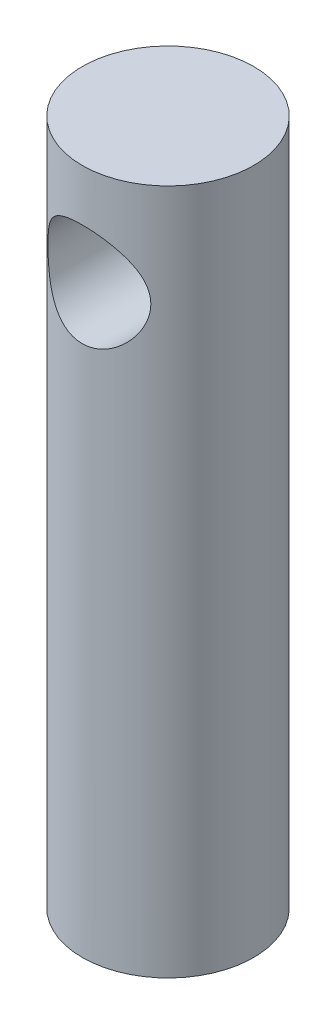
from build123d import *

# Parameters (mm, degrees)
SKETCH_1_R               = 125
EXTRUDE_1_DEPTH          = 1000
CUT_EXTRUDE_1_DEPTH      = 1016.504800579
CUT_EXTRUDE_1_DEPTH_BACK = 1016.504800579
SKETCH_3_R               = 75


with BuildPart() as part:
    # 草图1 → 凸台-拉伸1 (new body)
    with BuildSketch(Plane(origin=(0, 0, 0), x_dir=(1, 0, 0), z_dir=(0, 1, 0))):
        with Locations(Location((0, 0, 0), (0, 0, 270))):
            Circle(SKETCH_1_R)
    extrude(amount=EXTRUDE_1_DEPTH)

    # 草图3 → 切除-拉伸1 (cut, two sides: drawn at the far end of the back side and taken through both)
    with BuildSketch(Plane.XY.offset(-CUT_EXTRUDE_1_DEPTH_BACK)):
        with Locations(Location((0, 850, 0), (0, 0, 90))):
            Circle(SKETCH_3_R)
    extrude(amount=CUT_EXTRUDE_1_DEPTH + CUT_EXTRUDE_1_DEPTH_BACK, mode=Mode.SUBTRACT)


solid = part.part
